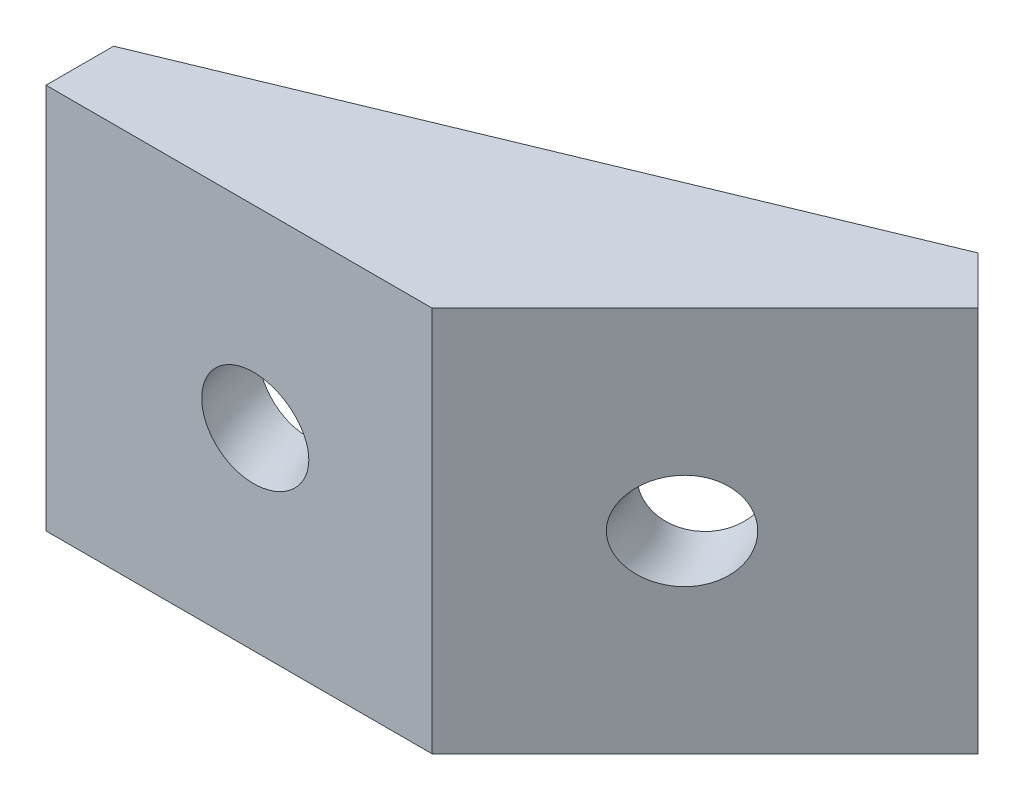
from build123d import *

# Parameters (mm, degrees)
BOSS_EXTRUDE1_DEPTH = 20
BOSS_EXTRUDE2_DEPTH = 2
BOSS_EXTRUDE3_START = -20
BOSS_EXTRUDE3_DEPTH = 2
SKETCH3_R           = 2.5


with BuildPart() as part:
    # Sketch1 → Boss-Extrude1 (new body)
    with BuildSketch(Plane(origin=(0, 0, 0), x_dir=(1, 0, 0), z_dir=(0, 1, 0))):
        Polygon((-20, 3.5), (-1.449747468, 3.5), (11.66726189, 16.617009358), (14.142135624, 14.142135624), (0, 0), (-20, 0), align=None)
    extrude(amount=BOSS_EXTRUDE1_DEPTH)

    # Sketch2 → Boss-Extrude2 (add)
    with BuildSketch(Plane(origin=(0, 20, 0), x_dir=(1, 0, 0), z_dir=(0, 1, 0))):
        Polygon((-20, 3.5), (11.66726189, 16.617009358), (-1.449747468, 3.5), align=None)
    extrude(amount=-BOSS_EXTRUDE2_DEPTH)

    # Sketch2<2> → Boss-Extrude3 (add)
    with BuildSketch(Plane(origin=(0, 20, 0), x_dir=(1, 0, 0), z_dir=(0, 1, 0)).offset(BOSS_EXTRUDE3_START)):
        Polygon((-20, 3.5), (11.66726189, 16.617009358), (-1.449747468, 3.5), align=None)
    extrude(amount=BOSS_EXTRUDE3_DEPTH)

    # Sketch3 → Cut-Revolve1 (revolve, cut)
    with BuildSketch(Plane(origin=(0, 0, -3.5), x_dir=(-1, 0, 0), z_dir=(0, 0, -1)), mode=Mode.PRIVATE) as cut_revolve1_sk:
        with Locations((10, 10)):
            Circle(SKETCH3_R)
    revolve(cut_revolve1_sk.sketch.rotate(Axis((-1.449747468, 20, -3.5), (0, -1, 0)), 350.498874786), axis=Axis((-1.449747468, 20, -3.5), (0, -1, 0)), mode=Mode.SUBTRACT)


solid = part.part
